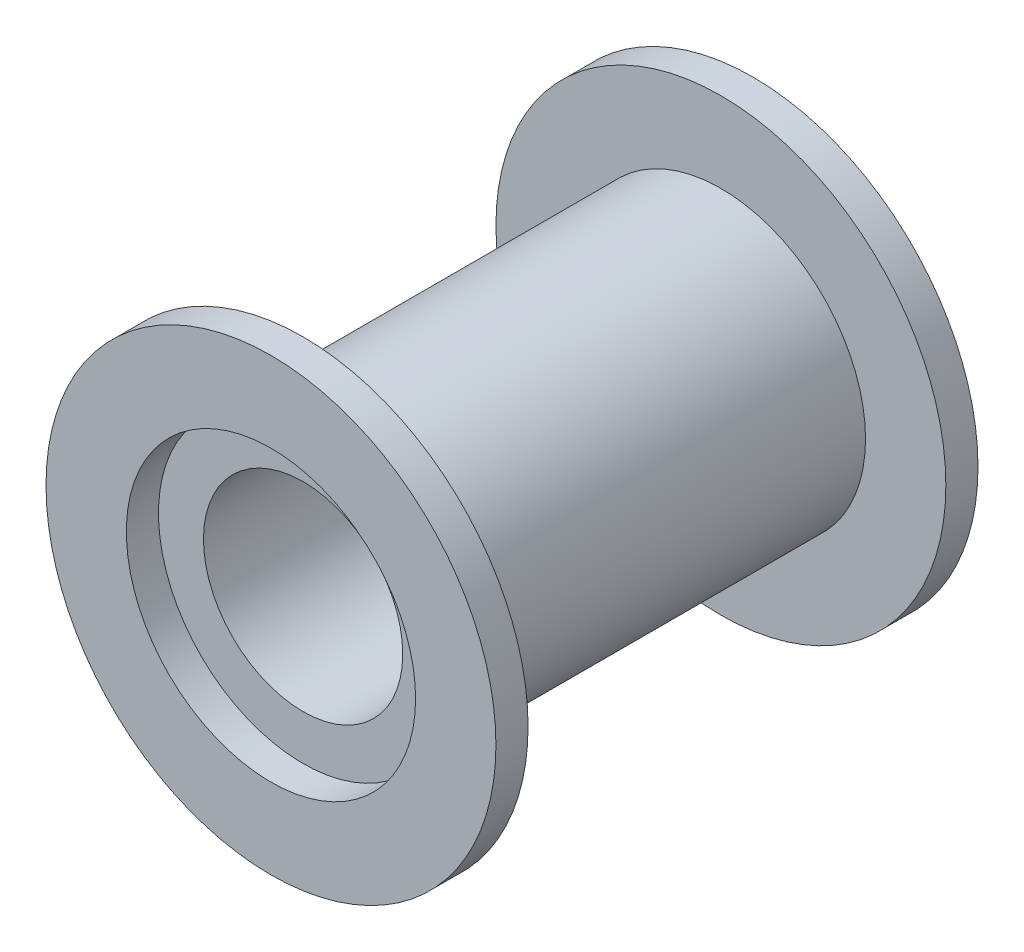
from build123d import *

# Parameters (mm, degrees)
SKETCH_1_R      = 4.5
SKETCH_1_R_2    = 3.1
EXTRUDE_2_DEPTH = 14
SKETCH_1_4_R    = 7
SKETCH_1_4_R_2  = 4.5
EXTRUDE_3_DEPTH = 1
SKETCH_2_R      = 7
SKETCH_2_R_2    = 4.5
EXTRUDE_4_DEPTH = 1


with BuildPart() as part:
    # Эскиз1 → Бобышка-Вытянуть2 (new body)
    with BuildSketch(Plane.XY):
        Circle(SKETCH_1_R)
        Circle(SKETCH_1_R_2, mode=Mode.SUBTRACT)
    extrude(amount=EXTRUDE_2_DEPTH)

    # Эскиз1<4> → Бобышка-Вытянуть3 (add)
    with BuildSketch(Plane.XY):
        Circle(SKETCH_1_4_R)
        Circle(SKETCH_1_4_R_2, mode=Mode.SUBTRACT)
    extrude(amount=EXTRUDE_3_DEPTH)


with BuildPart() as body_2:
    # Эскиз2 → Бобышка-Вытянуть4 (new body)
    with BuildSketch(Plane.XY.offset(14)):
        Circle(SKETCH_2_R)
        Circle(SKETCH_2_R_2, mode=Mode.SUBTRACT)
    extrude(amount=EXTRUDE_4_DEPTH)


solid = Compound([part.part, body_2.part])
